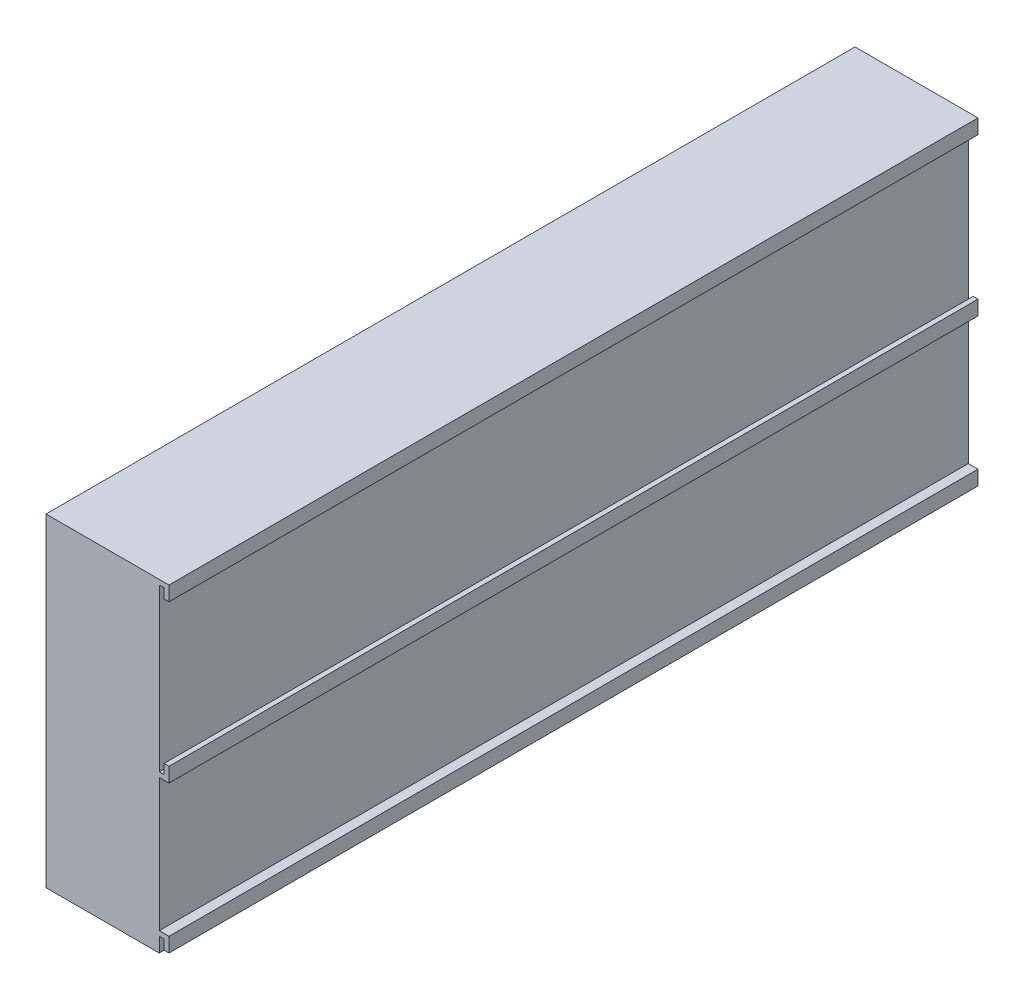
from build123d import *

# Parameters (mm, degrees)
SALIENTE_EXTRUIR1_DEPTH = 250


with BuildPart() as part:
    # Croquis1 → Saliente-Extruir1 (new body)
    with BuildSketch(Plane.XY):
        Polygon((17.5, 50), (20.5, 50), (20.5, 45.5), (19, 45.5), (19, 48.5), (17.5, 48.5), (17.5, -1.5), (19, -1.5), (19, 1.5), (20.5, 1.5), (20.5, -3), (17.5, -3), (17.5, -44), (20.5, -44), (20.5, -48.5), (19, -48.5), (19, -45.5), (17.5, -45.5), (17.5, -50), (-17.5, -50), (-17.5, 50), align=None)
    extrude(amount=SALIENTE_EXTRUIR1_DEPTH)


solid = part.part
